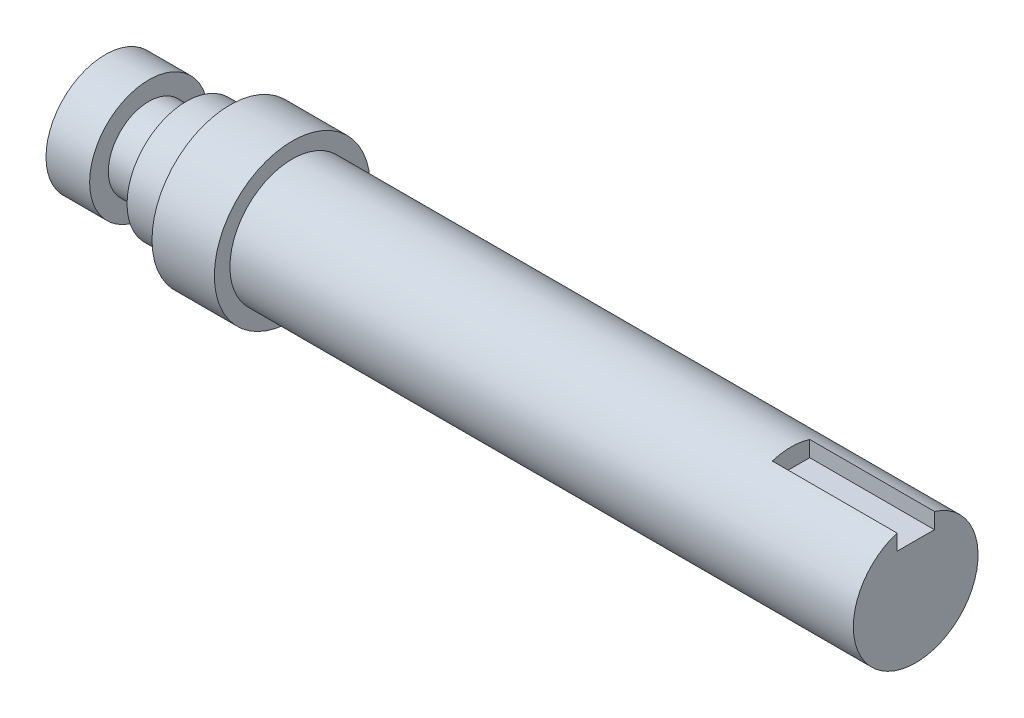
from build123d import *

# Parameters (mm, degrees)
IZIM3_W               = 6
IZIM3_H               = 3
IZIM4_W               = 20
IZIM4_H               = 5
KES_EKSTR_ZYON1_DEPTH = 3


with BuildPart() as part:
    # Çizim2 → Döndür1 (revolve)
    with BuildSketch(Plane.XY, mode=Mode.PRIVATE) as d_nd_r1_sk:
        Polygon((0, 0), (0, 10), (-100, 10), (-100, 12.5), (-110, 12.5), (-110, 9.5), (-130, 9.5), (-130, 0), align=None)
    revolve(d_nd_r1_sk.sketch.rotate(Axis((-130, 0, 0), (1, 0, 0)), 90), axis=Axis((-130, 0, 0), (1, 0, 0)))

    # Çizim3 → Kes-Döndür1 (revolve, cut)
    with BuildSketch(Plane.XY, mode=Mode.PRIVATE) as kes_d_nd_r1_sk:
        with Locations((-120, 8)):
            Rectangle(IZIM3_W, IZIM3_H)
    revolve(kes_d_nd_r1_sk.sketch.rotate(Axis((-130, 0, 0), (1, 0, 0)), 90), axis=Axis((-130, 0, 0), (1, 0, 0)), mode=Mode.SUBTRACT)

    # Çizim4 → Kes-Ekstrüzyon1 (cut, symmetric)
    with BuildSketch(Plane.XY):
        with Locations((-10, 9.5)):
            Rectangle(IZIM4_W, IZIM4_H)
    extrude(amount=KES_EKSTR_ZYON1_DEPTH, both=True, mode=Mode.SUBTRACT)


solid = part.part
